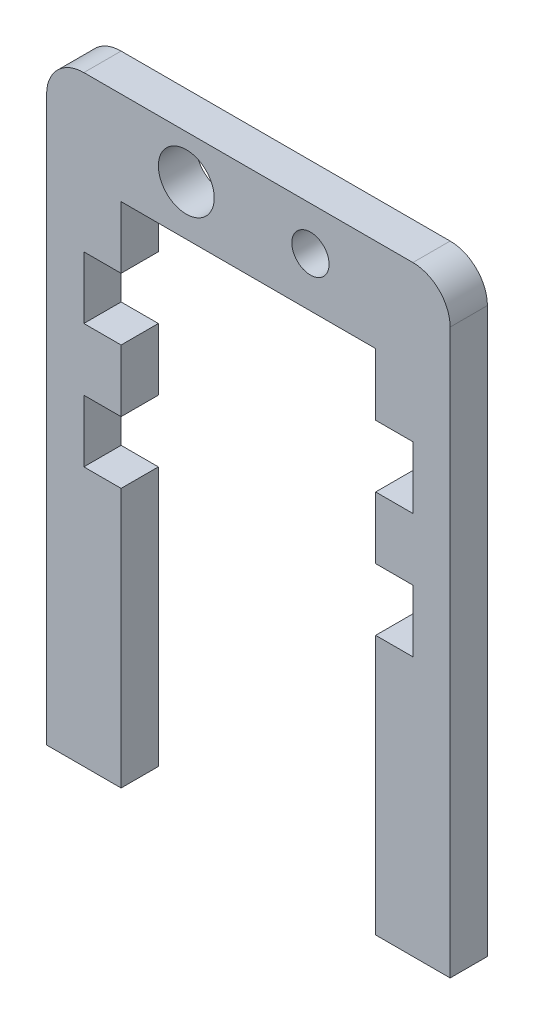
from build123d import *

# Parameters (mm, degrees)
SKETCH1_R             = 2.25
SKETCH1_R_2           = 1.5
BOSS_EXTRUDE1_DEPTH   = 3
CORTAR_EXTRUIR1_REACH = 34.469
CROQUIS1_W            = 32.5
CROQUIS1_H            = 7.5


with BuildPart() as part:
    # Sketch1 → Boss-Extrude1 (new body)
    with BuildSketch(Plane.XY):
        with BuildLine():
            Line((-13.25, 27.95), (13.25, 27.95))
            ThreePointArc((13.25, 27.95), (15.371320344, 27.071320344), (16.25, 24.95))
            Line((16.25, 24.95), (16.25, -24.95))
            ThreePointArc((16.25, -24.95), (15.371320344, -27.071320344), (13.25, -27.95))
            Line((13.25, -27.95), (-13.25, -27.95))
            ThreePointArc((-13.25, -27.95), (-15.371320344, -27.071320344), (-16.25, -24.95))
            Line((-16.25, -24.95), (-16.25, 24.95))
            ThreePointArc((-16.25, 24.95), (-15.371320344, 27.071320344), (-13.25, 27.95))
        make_face()
        with Locations((-5, 24.45)):
            Circle(SKETCH1_R, mode=Mode.SUBTRACT)
        with Locations((5, 24.45)):
            Circle(SKETCH1_R_2, mode=Mode.SUBTRACT)
        with Locations(Location((5, -24.45, 0), (0, 0, 180))):
            Circle(SKETCH1_R_2, mode=Mode.SUBTRACT)
        with Locations(Location((-5, -24.45, 0), (0, 0, 180))):
            Circle(SKETCH1_R, mode=Mode.SUBTRACT)
        Polygon((-10.25, 20.45), (10.25, 20.45), (10.25, 15.45), (13.25, 15.45), (13.25, 10.45), (10.25, 10.45), (10.25, 5.45), (13.25, 5.45), (13.25, 0.45), (10.25, 0.45), (10.25, -20.45), (-10.25, -20.45), (-10.25, 0.45), (-13.25, 0.45), (-13.25, 5.45), (-10.25, 5.45), (-10.25, 10.45), (-13.25, 10.45), (-13.25, 15.45), (-10.25, 15.45), align=None, mode=Mode.SUBTRACT)
    extrude(amount=BOSS_EXTRUDE1_DEPTH)

    # Croquis1 → Cortar-Extruir1 (cut, up to next)
    with BuildSketch(Plane.XY.offset(3), mode=Mode.PRIVATE) as cortar_extruir1_sk1:
        with Locations((0, -24.2)):
            Rectangle(CROQUIS1_W, CROQUIS1_H)
    cortar_extruir1_tool1 = extrude(cortar_extruir1_sk1.sketch, amount=-CORTAR_EXTRUIR1_REACH, mode=Mode.PRIVATE) & part.part
    add(cortar_extruir1_tool1.solids().sort_by_distance((0, -24.2, 3))[0], mode=Mode.SUBTRACT)


solid = part.part
